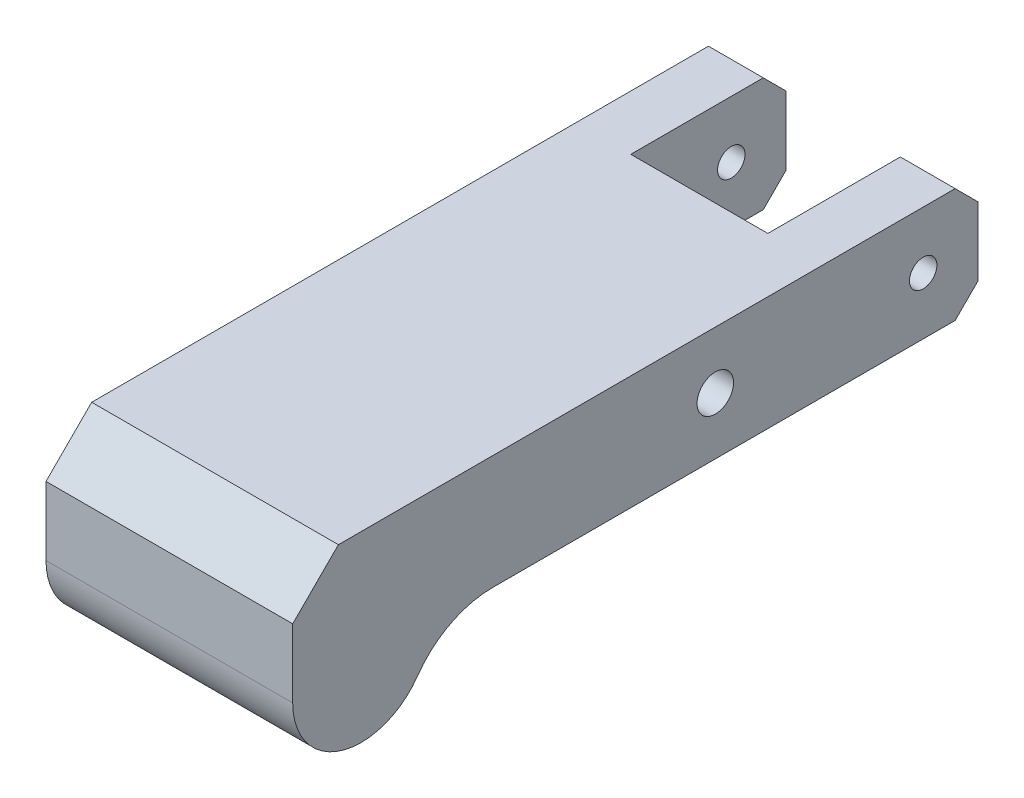
from build123d import *

# Parameters (mm, degrees)
Y_KSEKLIK_EKSTR_ZYON1_DEPTH = 54
IZIM2_W                     = 30
IZIM2_H                     = 34
KES_EKSTR_ZYON1_DEPTH       = 198.254628411
IZIM3_R                     = 3
IZIM3_R_2                   = 4
KES_EKSTR_ZYON2_DEPTH       = 195.660969988


with BuildPart() as part:
    # Çizim1 → Yükseklik-Ekstrüzyon1 (new body)
    with BuildSketch(Plane(origin=(0, 0, 0), x_dir=(0, 0, -1), z_dir=(1, 0, 0))):
        with BuildLine():
            Line((-185.454545455, 5.844155844), (-175.454545455, 15.844155844))
            Line((-175.454545455, 15.844155844), (-40.454545455, 15.844155844))
            Line((-40.454545455, 15.844155844), (-35.454545455, 10.844155844))
            Line((-35.454545455, 10.844155844), (-35.454545455, -4.155844156))
            Line((-35.454545455, -4.155844156), (-40.454545455, -9.155844156))
            Line((-40.454545455, -9.155844156), (-141.731732222, -9.155844156))
            ThreePointArc((-141.731732222, -9.155844156), (-150.98993322, -11.427738947), (-158.144768355, -17.727272727))
            ThreePointArc((-158.144768355, -17.727272727), (-174.946390482, -23.467494244), (-185.454545455, -9.155844156))
            Line((-185.454545455, -9.155844156), (-185.454545455, 5.844155844))
        make_face()
    extrude(amount=Y_KSEKLIK_EKSTR_ZYON1_DEPTH)

    # Çizim2 → Kes-Ekstrüzyon1 (cut, through all)
    with BuildSketch(Plane(origin=(0, 15.844155844, 0), x_dir=(1, 0, 0), z_dir=(0, 1, 0))):
        with Locations((27, -52.454545455)):
            Rectangle(IZIM2_W, IZIM2_H)
    extrude(amount=-KES_EKSTR_ZYON1_DEPTH, mode=Mode.SUBTRACT)

    # Çizim3 → Kes-Ekstrüzyon2 (cut, through all)
    with BuildSketch(Plane(origin=(54, 0, 0), x_dir=(0, 0, -1), z_dir=(1, 0, 0))):
        with Locations((-47.454545455, 3.344155844)):
            Circle(IZIM3_R)
        with Locations((-92.954545455, 3.344155844)):
            Circle(IZIM3_R_2)
    extrude(amount=-KES_EKSTR_ZYON2_DEPTH, mode=Mode.SUBTRACT)


solid = part.part
